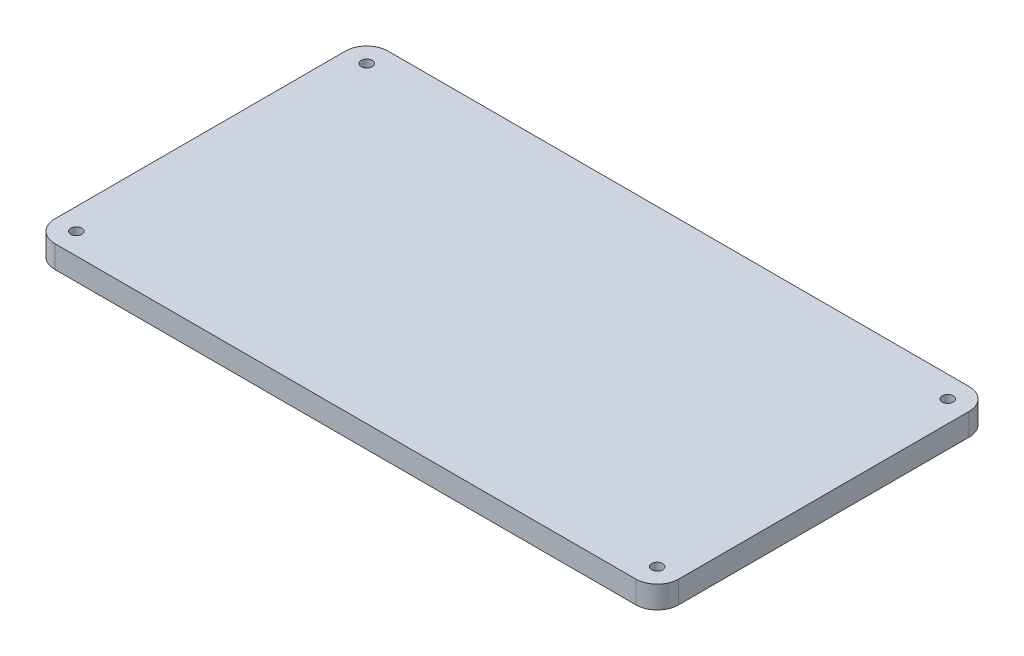
from build123d import *

# Parameters (mm, degrees)
SKETCH_2_R      = 1.225
EXTRUDE_2_DEPTH = 5


with BuildPart() as part:
    # 草图2 → 凸台-拉伸2 (new body)
    with BuildSketch(Plane(origin=(0, 0, 0), x_dir=(1, 0, 0), z_dir=(0, 1, 0))):
        with BuildLine():
            Line((69.8, 27.5), (69.8, -37.5))
            ThreePointArc((69.8, -37.5), (68.39411255, -40.89411255), (65, -42.3))
            Line((65, -42.3), (-65, -42.3))
            ThreePointArc((-65, -42.3), (-68.39411255, -40.89411255), (-69.8, -37.5))
            Line((-69.8, -37.5), (-69.8, 27.5))
            ThreePointArc((-69.8, 27.5), (-68.39411255, 30.89411255), (-65, 32.3))
            Line((-65, 32.3), (65, 32.3))
            ThreePointArc((65, 32.3), (68.39411255, 30.89411255), (69.8, 27.5))
        make_face()
        with Locations(Location((-65, 27.5, 0), (0, 0, 270))):
            Circle(SKETCH_2_R, mode=Mode.SUBTRACT)
        with Locations(Location((65, 27.5, 0), (0, 0, 270))):
            Circle(SKETCH_2_R, mode=Mode.SUBTRACT)
        with Locations(Location((65, -37.5, 0), (0, 0, 270))):
            Circle(SKETCH_2_R, mode=Mode.SUBTRACT)
        with Locations(Location((-65, -37.5, 0), (0, 0, 270))):
            Circle(SKETCH_2_R, mode=Mode.SUBTRACT)
    extrude(amount=EXTRUDE_2_DEPTH)


solid = part.part
